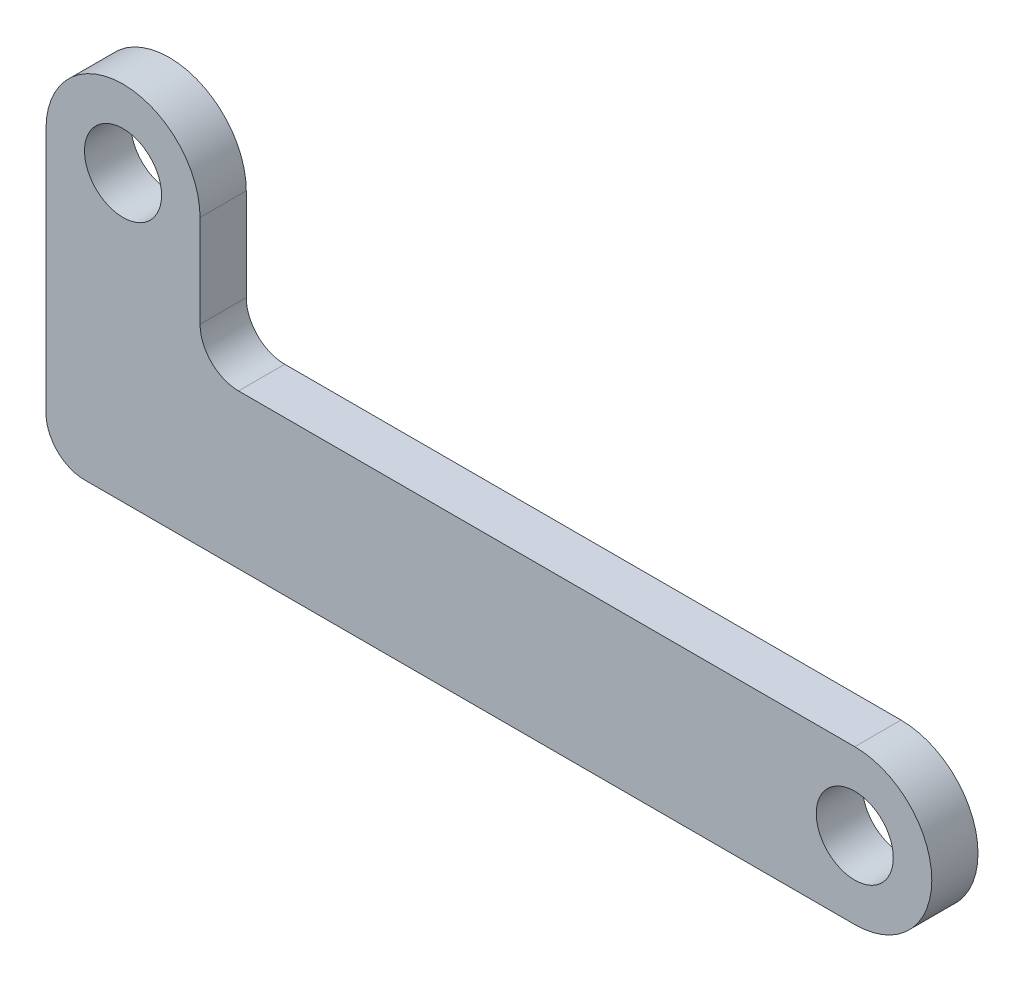
from build123d import *

# Parameters (mm, degrees)
SKETCH_2_R      = 2.5
EXTRUDE_1_DEPTH = 3


with BuildPart() as part:
    # Эскиз2 → Вытянуть1 (new body)
    with BuildSketch(Plane.XY):
        with BuildLine():
            Line((5, 0), (5, -6))
            ThreePointArc((5, -6), (5.732233047, -7.767766953), (7.5, -8.5))
            Line((7.5, -8.5), (47.5, -8.5))
            ThreePointArc((47.5, -8.5), (52.5, -13.5), (47.5, -18.5))
            Line((47.5, -18.5), (-2.5, -18.5))
            ThreePointArc((-2.5, -18.5), (-4.267766953, -17.767766953), (-5, -16))
            Line((-5, -16), (-5, 0))
            ThreePointArc((-5, 0), (0, 5), (5, 0))
        make_face()
        Circle(SKETCH_2_R, mode=Mode.SUBTRACT)
        with Locations((47.5, -13.5)):
            Circle(SKETCH_2_R, mode=Mode.SUBTRACT)
    extrude(amount=EXTRUDE_1_DEPTH)


solid = part.part
